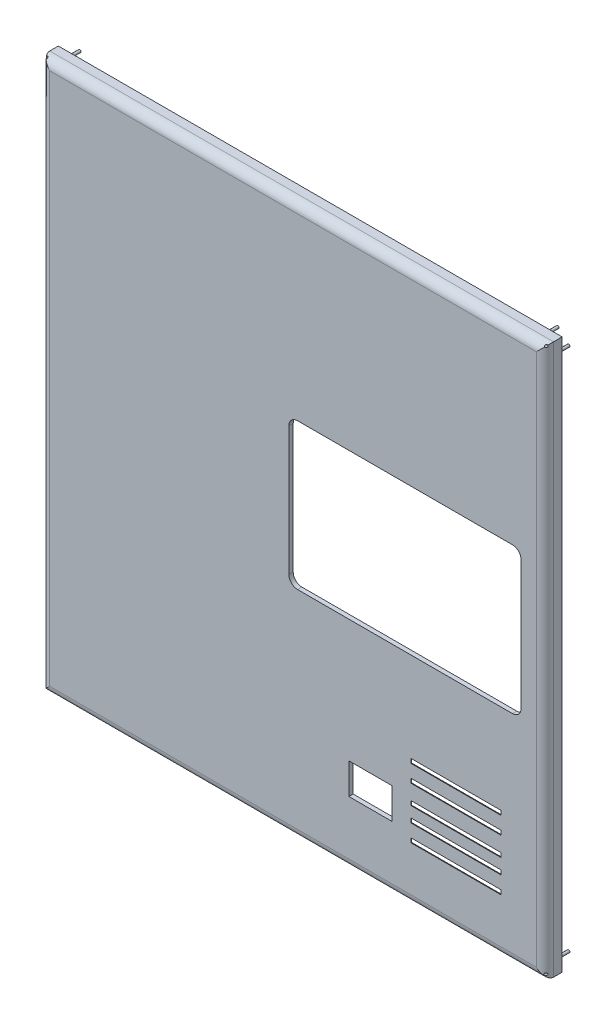
from build123d import *

# Parameters (mm, degrees)
SKETCH1_W                                           = 586
SKETCH1_H                                           = 640
BOSS_EXTRUDE1_DEPTH                                 = 20
FILLET1_R                                           = 10
SHELL1_T                                            = -5
SKETCH2_R                                           = 1.5
BOSS_EXTRUDE2_DEPTH                                 = 10
CSK_FOR_M2_COUNTERSUNK_FLAT_HEAD_SCREW2_D           = 2.4
CSK_FOR_M2_COUNTERSUNK_FLAT_HEAD_SCREW2_DEPTH       = 30
CSK_FOR_M2_COUNTERSUNK_FLAT_HEAD_SCREW2_CSINK_D     = 4.4
CSK_FOR_M2_COUNTERSUNK_FLAT_HEAD_SCREW2_CSINK_ANGLE = 90
CSK_FOR_M2_COUNTERSUNK_FLAT_HEAD_SCREW2_TIP         = 0.721032743
CUT_EXTRUDE1_DEPTH                                  = 10
SKETCH8_W                                           = 105
SKETCH8_H                                           = 5
CUT_EXTRUDE2_DEPTH                                  = 10
CUT_EXTRUDE2_TAPER                                  = -40
SKETCH9_W                                           = 50.083754714
SKETCH9_H                                           = 35.967624765
CUT_EXTRUDE3_DEPTH                                  = 10


with BuildPart() as part:
    # Sketch1 → Boss-Extrude1 (new body)
    with BuildSketch(Plane.XY):
        Rectangle(SKETCH1_W, SKETCH1_H)
    extrude(amount=-BOSS_EXTRUDE1_DEPTH)

    # Fillet1
    fillet1_edges = [part.edges().sort_by_distance(p)[0] for p in [
        (0, -320, 0),
        (-293, 0, 0),
        (0, 320, 0),
        (293, 0, 0),
    ]]
    fillet(fillet1_edges, radius=FILLET1_R)

    # Shell1
    shell1_openings = [part.faces().sort_by_distance(p)[0] for p in [
        (0, 0, -20),
    ]]
    offset(amount=SHELL1_T, openings=shell1_openings)

    # Sketch2 → Boss-Extrude2 (add)
    with BuildSketch(Plane(origin=(0, 0, -20), x_dir=(-1, 0, 0), z_dir=(0, 0, -1))):
        with Locations((-278, 317.5)):
            Circle(SKETCH2_R)
        with Locations((-290.5, 305)):
            Circle(SKETCH2_R)
        with Locations((-290.5, -305)):
            Circle(SKETCH2_R)
        with Locations((290.5, -305)):
            Circle(SKETCH2_R)
        with Locations((290.5, 305)):
            Circle(SKETCH2_R)
        with Locations((278, 317.5)):
            Circle(SKETCH2_R)
    extrude(amount=BOSS_EXTRUDE2_DEPTH)

    # CSK for M2 Countersunk Flat Head Screw2
    with Locations(Plane.XY):
        with Locations((-290.5, 317.5), (290.5, -315), (-290.5, -315), (290.5, 317.5)):
            CounterSinkHole(CSK_FOR_M2_COUNTERSUNK_FLAT_HEAD_SCREW2_D / 2, CSK_FOR_M2_COUNTERSUNK_FLAT_HEAD_SCREW2_CSINK_D / 2, depth=CSK_FOR_M2_COUNTERSUNK_FLAT_HEAD_SCREW2_DEPTH, counter_sink_angle=CSK_FOR_M2_COUNTERSUNK_FLAT_HEAD_SCREW2_CSINK_ANGLE)
            with Locations((0, 0, -(CSK_FOR_M2_COUNTERSUNK_FLAT_HEAD_SCREW2_DEPTH + CSK_FOR_M2_COUNTERSUNK_FLAT_HEAD_SCREW2_TIP / 2))):  # 118° drill point
                Cone(0, CSK_FOR_M2_COUNTERSUNK_FLAT_HEAD_SCREW2_D / 2, CSK_FOR_M2_COUNTERSUNK_FLAT_HEAD_SCREW2_TIP, mode=Mode.SUBTRACT)

    # Sketch7 → Cut-Extrude1 (cut)
    with BuildSketch(Plane.XY):
        with BuildLine():
            Line((5.250491342, 101.67028692), (255.250491342, 101.67028692))
            ThreePointArc((255.250491342, 101.67028692), (262.321559154, 98.741354732), (265.250491342, 91.67028692))
            Line((265.250491342, 91.67028692), (265.250491342, -58.32971308))
            ThreePointArc((265.250491342, -58.32971308), (262.321559154, -65.400780892), (255.250491342, -68.32971308))
            Line((255.250491342, -68.32971308), (5.250491342, -68.32971308))
            ThreePointArc((5.250491342, -68.32971308), (-1.82057647, -65.400780892), (-4.749508658, -58.32971308))
            Line((-4.749508658, -58.32971308), (-4.749508658, 91.67028692))
            ThreePointArc((-4.749508658, 91.67028692), (-1.82057647, 98.741354732), (5.250491342, 101.67028692))
        make_face()
    extrude(amount=-CUT_EXTRUDE1_DEPTH, mode=Mode.SUBTRACT)

    # Sketch8 → Cut-Extrude2 (cut)
    with BuildSketch(Plane.XY):
        with Locations((189.5, -175)):
            Rectangle(SKETCH8_W, SKETCH8_H)
        with Locations((189.5, -195)):
            Rectangle(SKETCH8_W, SKETCH8_H)
        with Locations((189.5, -217.5)):
            Rectangle(SKETCH8_W, SKETCH8_H)
        with Locations((189.5, -235)):
            Rectangle(SKETCH8_W, SKETCH8_H)
        with Locations((189.5, -255)):
            Rectangle(SKETCH8_W, SKETCH8_H)
    extrude(amount=-CUT_EXTRUDE2_DEPTH, taper=CUT_EXTRUDE2_TAPER, mode=Mode.SUBTRACT)

    # Sketch9 → Cut-Extrude3 (cut)
    with BuildSketch(Plane.XY):
        with Locations((89.92344879, -229.017138461)):
            Rectangle(SKETCH9_W, SKETCH9_H)
    extrude(amount=-CUT_EXTRUDE3_DEPTH, mode=Mode.SUBTRACT)


solid = part.part
